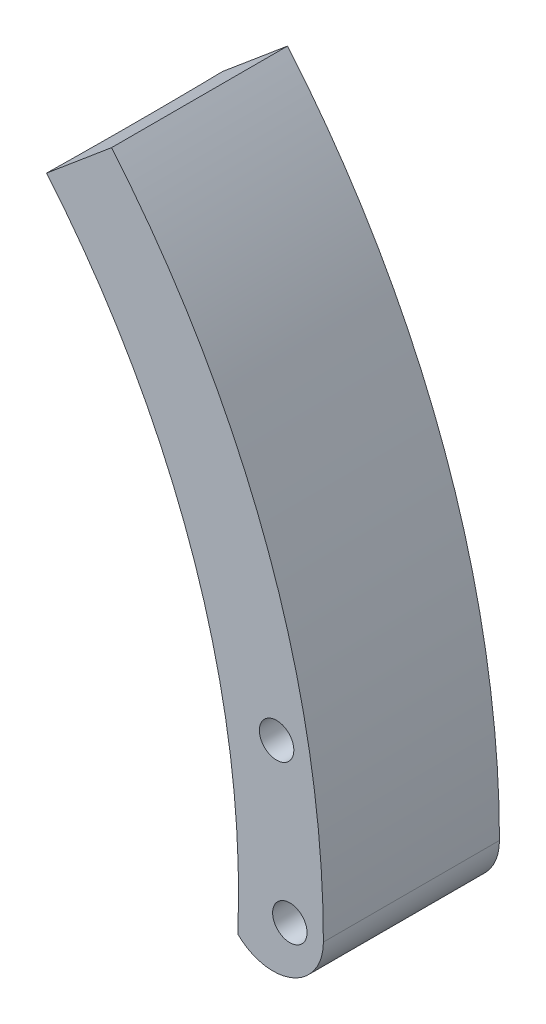
from build123d import *

# Parameters (mm, degrees)
BOSS_EXTRUDE1_DEPTH      = 16.66875
BOSS_EXTRUDE1_DEPTH_BACK = 16.66875
SKETCH2_R                = 3.2639


with BuildPart() as part:
    # Sketch2 → Boss-Extrude1 (new, two sides: drawn at the far end of the back side and taken through both)
    with BuildSketch(Plane.XY.offset(-BOSS_EXTRUDE1_DEPTH_BACK)):
        with BuildLine():
            Line((116.745173131, 97.960831716), (131.338319773, 110.205935681))
            ThreePointArc((131.338319773, 110.205935681), (161.110299834, 58.639353573), (171.45, 0))
            ThreePointArc((171.45, 0), (161.925, -9.525), (152.4, 0))
            ThreePointArc((152.4, 0), (143.209155408, 52.123869843), (116.745173131, 97.960831716))
        make_face()
        with Locations((165.1, 0)):
            Circle(SKETCH2_R, mode=Mode.SUBTRACT)
        with Locations((162.591760022, 28.669314133)):
            Circle(SKETCH2_R, mode=Mode.SUBTRACT)
    extrude(amount=BOSS_EXTRUDE1_DEPTH + BOSS_EXTRUDE1_DEPTH_BACK)

    # Sketch3 → Cut-Revolve2 (revolve, cut)
    with BuildSketch(Plane(origin=(0, 0, 0), x_dir=(1, 0, 0), z_dir=(0, 1, 0))):
        with BuildLine():
            Line((31.75, 0), (31.75, 124.757705173))
            ThreePointArc((31.75, 124.757705173), (156.507705173, 0), (31.75, -124.757705173))
            Line((31.75, -124.757705173), (31.75, 0))
        make_face()
    revolve(axis=Axis((0, 0, 1000), (0, 0, -1)), mode=Mode.SUBTRACT)


solid = part.part
